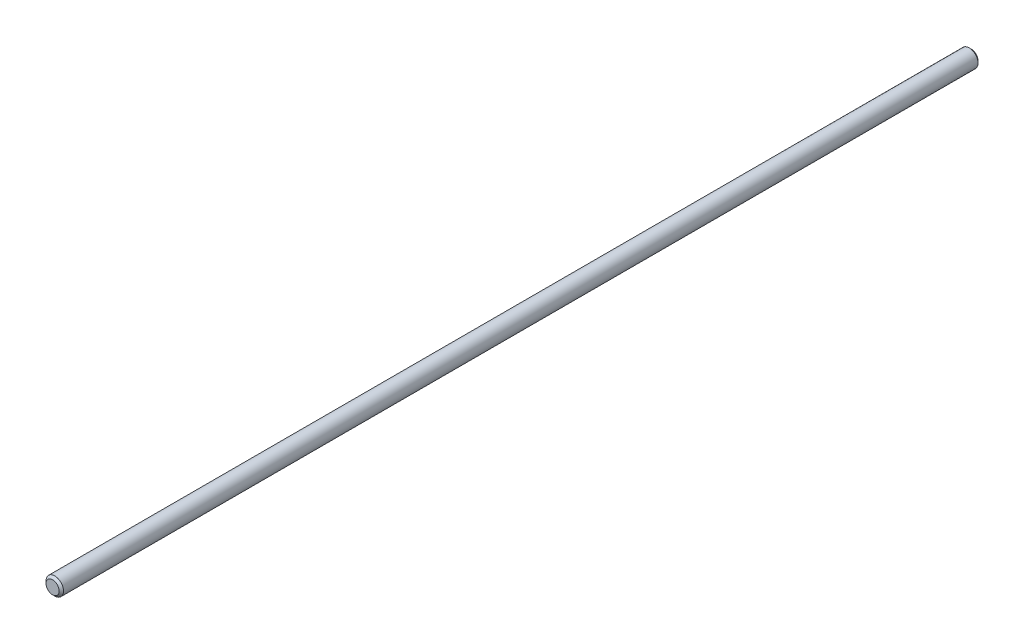
from build123d import *

# Parameters (mm, degrees)
SKETCH_1_R      = 4
EXTRUDE_1_DEPTH = 420
CHAMFER_1_SIZE  = 1


with BuildPart() as part:
    # 草图1 → 凸台-拉伸1 (new body)
    with BuildSketch(Plane.XY):
        Circle(SKETCH_1_R)
    extrude(amount=EXTRUDE_1_DEPTH)

    # 倒角1
    chamfer_1_edges = [part.edges().sort_by_distance(p)[0] for p in [
        (-4, 0, 0),
        (-4, 0, 420),
    ]]
    chamfer(chamfer_1_edges, length=CHAMFER_1_SIZE)


solid = part.part
